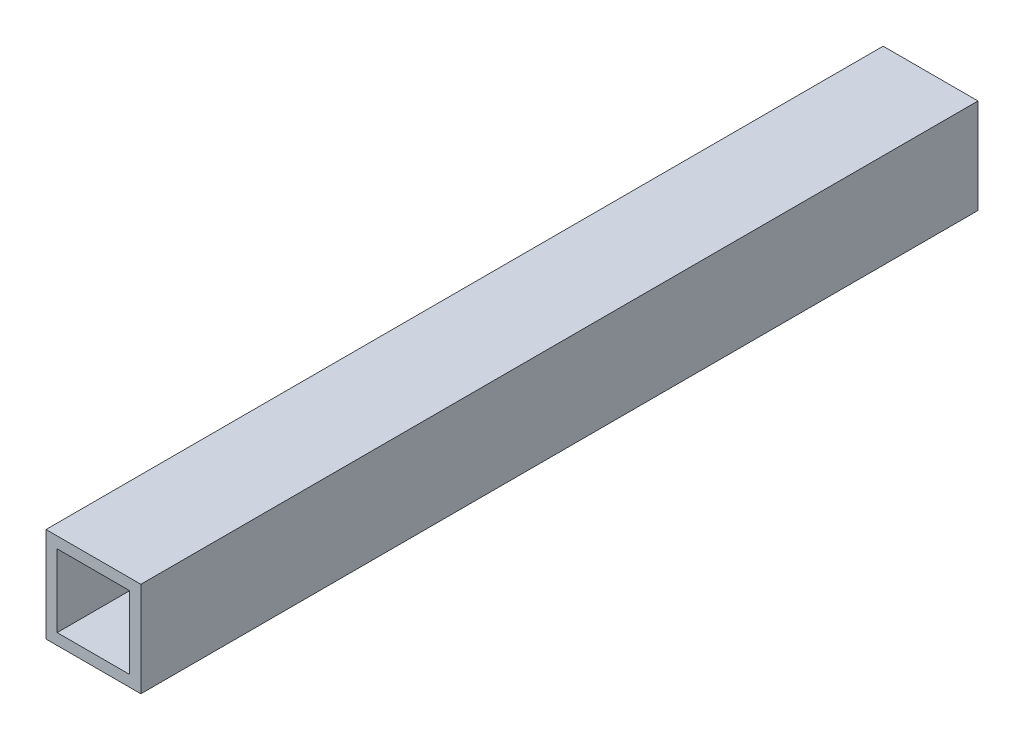
from build123d import *

# Parameters (mm, degrees)
SKETCH1_W           = 17
SKETCH1_H           = 17
SKETCH1_W_2         = 13
SKETCH1_H_2         = 13
BOSS_EXTRUDE1_DEPTH = 150


with BuildPart() as part:
    # Sketch1 → Boss-Extrude1 (new body)
    with BuildSketch(Plane.XY):
        Rectangle(SKETCH1_W, SKETCH1_H)
        Rectangle(SKETCH1_W_2, SKETCH1_H_2, mode=Mode.SUBTRACT)
    extrude(amount=BOSS_EXTRUDE1_DEPTH)


solid = part.part
